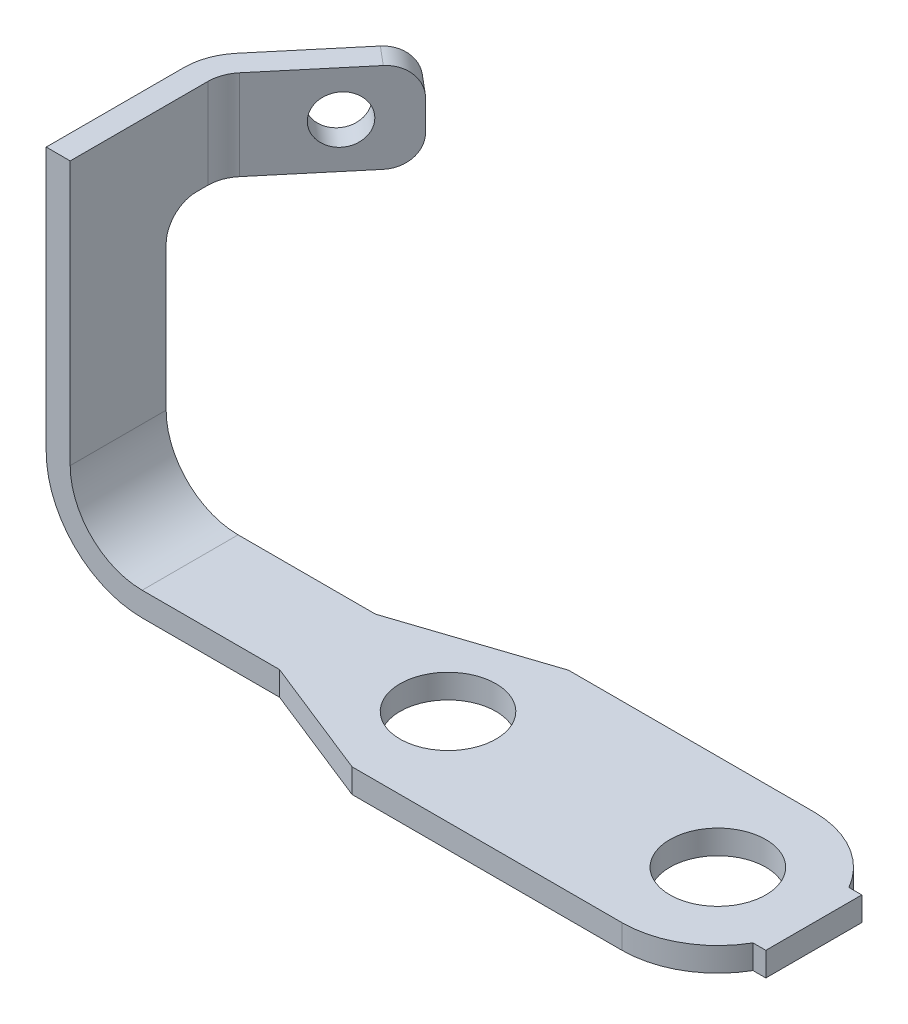
from build123d import *

# Parameters (mm, degrees)
EXTRUDE_THIN1_DEPTH = 8
BOSS_EXTRUDE4_DEPTH = 4
SKETCH3_3_R         = 8
CUT_EXTRUDE1_DEPTH  = 4
EXTRUDE_THIN2_DEPTH = 15
FILLET1_R           = 5
FILLET2_R           = 5
SKETCH5_R           = 4
CUT_EXTRUDE2_DEPTH  = 15


with BuildPart() as part:
    # Sketch1 → Extrude-Thin1 (new, symmetric)
    with BuildSketch(Plane.XY):
        with BuildLine():
            Line((0, 0), (-104, 0))
            ThreePointArc((-104, 0), (-115.313708499, 4.686291501), (-120, 16))
            Line((-120, 16), (-120, 60))
            Line((-120, 60), (-116, 60))
            Line((-116, 60), (-116, 16))
            ThreePointArc((-116, 16), (-112.485281374, 7.514718626), (-104, 4))
            Line((-104, 4), (0, 4))
            Line((0, 4), (0, 0))
        make_face()
    extrude(amount=EXTRUDE_THIN1_DEPTH, both=True)

    # Sketch3 → Boss-Extrude4 (add)
    with BuildSketch(Plane(origin=(0, 4, 0), x_dir=(1, 0, 0), z_dir=(0, 1, 0))):
        with BuildLine():
            Line((-81.100288315, 8), (-61, 8))
            ThreePointArc((-61, 8), (-53, 0), (-61, -8))
            Line((-61, -8), (-81.100288315, -8))
            Line((-81.100288315, -8), (-61, -16))
            Line((-61, -16), (-16, -16))
            ThreePointArc((-16, -16), (-8, -13.856406461), (-2.143593539, -8))
            Line((-2.143593539, -8), (-29.856406461, -8))
            ThreePointArc((-29.856406461, -8), (-32, 0), (-29.856406461, 8))
            Line((-29.856406461, 8), (-2.143593539, 8))
            ThreePointArc((-2.143593539, 8), (-8, 13.856406461), (-16, 16))
            Line((-16, 16), (-56.906606086, 16))
            Line((-56.906606086, 16), (-81.100288315, 8))
        make_face()
    extrude(amount=-BOSS_EXTRUDE4_DEPTH)

    # Sketch3<3> → Cut-Extrude1 (cut)
    with BuildSketch(Plane(origin=(0, 4, 0), x_dir=(1, 0, 0), z_dir=(0, 1, 0))):
        with Locations((-16, 0)):
            Circle(SKETCH3_3_R)
        with Locations((-61, 0)):
            Circle(SKETCH3_3_R)
    extrude(amount=-CUT_EXTRUDE1_DEPTH, mode=Mode.SUBTRACT)

    # Sketch4 → Extrude-Thin2 (add)
    with BuildSketch(Plane(origin=(0, 60, 0), x_dir=(1, 0, 0), z_dir=(0, 1, 0))):
        with BuildLine():
            Line((-120, 8), (-120, 15))
            ThreePointArc((-120, 15), (-119.396926208, 18.420201433), (-117.660444431, 21.427876097))
            Line((-117.660444431, 21.427876097), (-103.519117018, 38.280853845))
            Line((-103.519117018, 38.280853845), (-100.454939246, 35.709703407))
            Line((-100.454939246, 35.709703407), (-114.596266659, 18.856725658))
            ThreePointArc((-114.596266659, 18.856725658), (-115.638155725, 17.05212086), (-116, 15))
            Line((-116, 15), (-116, 8))
            Line((-116, 8), (-120, 8))
        make_face()
    extrude(amount=-EXTRUDE_THIN2_DEPTH)

    # Fillet1
    fillet1_edges = [part.edges().sort_by_distance(p)[0] for p in [
        (-118, 45, -8),
    ]]
    fillet(fillet1_edges, radius=FILLET1_R)

    # Fillet2
    fillet2_edges = [part.edges().sort_by_distance(p)[0] for p in [
        (-101.987028132, 45, -36.995278626),
        (-101.987028132, 60, -36.995278626),
    ]]
    fillet(fillet2_edges, radius=FILLET2_R)

    # Sketch5 → Cut-Extrude2 (cut)
    with BuildSketch(Plane(origin=(-76.532974578, 0, -64.218790741), x_dir=(0.6427876096865437, 0, -0.7660444431189745), z_dir=(0.7660444431189746, 0, 0.6427876096865437))):
        with Locations((-47.215970419, 52.5)):
            Circle(SKETCH5_R)
    extrude(amount=-CUT_EXTRUDE2_DEPTH, mode=Mode.SUBTRACT)


solid = part.part
